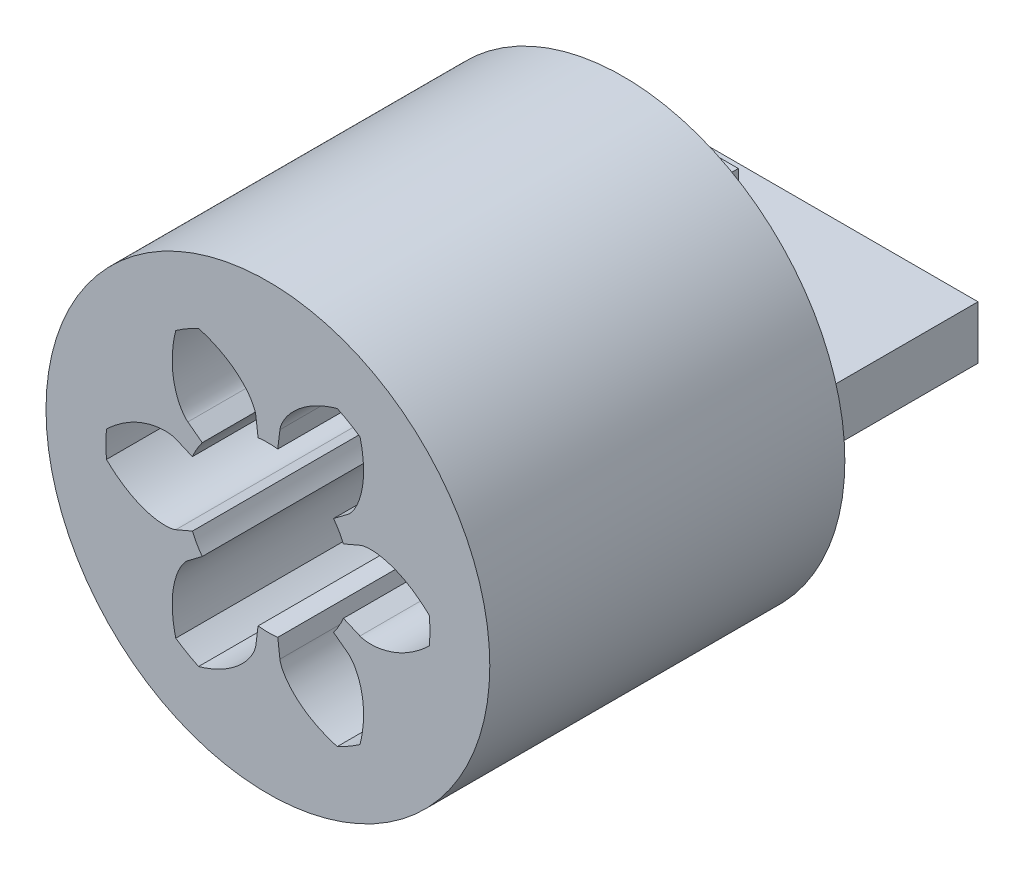
from build123d import *

# Parameters (mm, degrees)
SKETCH_1_R               = 2.5
SKETCH_1_R_2             = 0.925
EXTRUDE_1_DEPTH          = 3
CUT_EXTRUDE_2_DEPTH      = 5.636809248
PATTERN_CIRCULAR_1_COUNT = 6
EXTRUDE_START            = 1
SKETCH_2_R               = 2.5
EXTRUDE_2_DEPTH          = 1
SKETCH_2_3_W             = 4
SKETCH_2_3_H             = 0.6
EXTRUDE_3_DEPTH          = 2
SKETCH_2_4_W             = 0.6
SKETCH_2_4_H             = 2.5
EXTRUDE_4_DEPTH          = 1


with BuildPart() as part:
    # 草图1 → 凸台-拉伸1 (new body)
    with BuildSketch(Plane.XY):
        Circle(SKETCH_1_R)
        Circle(SKETCH_1_R_2, mode=Mode.SUBTRACT)
    extrude(amount=EXTRUDE_1_DEPTH)

    # 草图1<3> → 切除-拉伸2 (cut, through all)
    with BuildSketch(Plane.XY):
        with BuildLine():
            Line((1.03720071, 0.442455292), (0.85081958, 0.362947713))
            ThreePointArc((0.85081958, 0.362947713), (0.906265169, 0.185225388), (0.925, 0))
            ThreePointArc((0.925, 0), (0.906265169, -0.185225388), (0.85081958, -0.362947713))
            Line((0.85081958, -0.362947713), (1.03720071, -0.442455292))
            add(Edge.make_bspline(
                [(1.03720071, -0.442455292), (1.04510701, -0.445828009), (1.067871965, -0.453596987), (1.113314547, -0.461522157), (1.188023144, -0.464138789), (1.284367459, -0.452433849), (1.404657298, -0.420054467), (1.538436606, -0.361310704), (1.660601931, -0.285147073), (1.748638649, -0.214154324), (1.79986288, -0.166729965), (1.818980117, -0.1481092)],
                knots=[0, 0, 0, 0, 0, 0.005604068, 0.015718248, 0.029959916, 0.048733667, 0.068727063, 0.096888892, 0.125050566, 0.14248965, 0.14248965, 0.14248965, 0.14248965, 0.14248965], degree=4))
            ThreePointArc((1.818980117, -0.1481092), (1.823494408, -0.074115744), (1.825, 0))
            ThreePointArc((1.825, 0), (1.823494408, 0.074115744), (1.818980117, 0.1481092))
            add(Edge.make_bspline(
                [(1.03720071, 0.442455292), (1.04510701, 0.445828009), (1.067871965, 0.453596987), (1.113314547, 0.461522157), (1.188023144, 0.464138789), (1.284367459, 0.452433849), (1.404657298, 0.420054467), (1.538436606, 0.361310704), (1.660601931, 0.285147073), (1.748638649, 0.214154324), (1.79986288, 0.166729965), (1.818980117, 0.1481092)],
                knots=[0, 0, 0, 0, 0, 0.005604068, 0.015718248, 0.029959916, 0.048733667, 0.068727063, 0.096888892, 0.125050566, 0.14248965, 0.14248965, 0.14248965, 0.14248965, 0.14248965], degree=4))
        make_face()
    cut_extrude_2 = extrude(amount=CUT_EXTRUDE_2_DEPTH, mode=Mode.SUBTRACT)

    # 阵列(圆周)1: 切除-拉伸2 ×6 about axis
    pattern_circular_1_axis = Axis((0, 0, 3), (0, 0, 1))
    for i in range(1, PATTERN_CIRCULAR_1_COUNT):
        add(cut_extrude_2.rotate(pattern_circular_1_axis, i * 360 / PATTERN_CIRCULAR_1_COUNT), mode=Mode.SUBTRACT)

    # 草图2 → 凸台-拉伸2 (add)
    with BuildSketch(Plane(origin=(0, 0, 0), x_dir=(-1, 0, 0), z_dir=(0, 0, -1)).offset(EXTRUDE_START)):
        Circle(SKETCH_2_R)
    extrude(amount=-EXTRUDE_2_DEPTH)

    # 草图2<3> → 凸台-拉伸3 (add)
    with BuildSketch(Plane(origin=(0, 0, 0), x_dir=(-1, 0, 0), z_dir=(0, 0, -1)).offset(EXTRUDE_START)):
        Rectangle(SKETCH_2_3_W, SKETCH_2_3_H)
    extrude(amount=EXTRUDE_3_DEPTH)

    # 草图2<4> → 凸台-拉伸4 (add)
    with BuildSketch(Plane(origin=(0, 0, 0), x_dir=(-1, 0, 0), z_dir=(0, 0, -1)).offset(EXTRUDE_START)):
        Rectangle(SKETCH_2_4_W, SKETCH_2_4_H)
    extrude(amount=EXTRUDE_4_DEPTH)


solid = part.part
